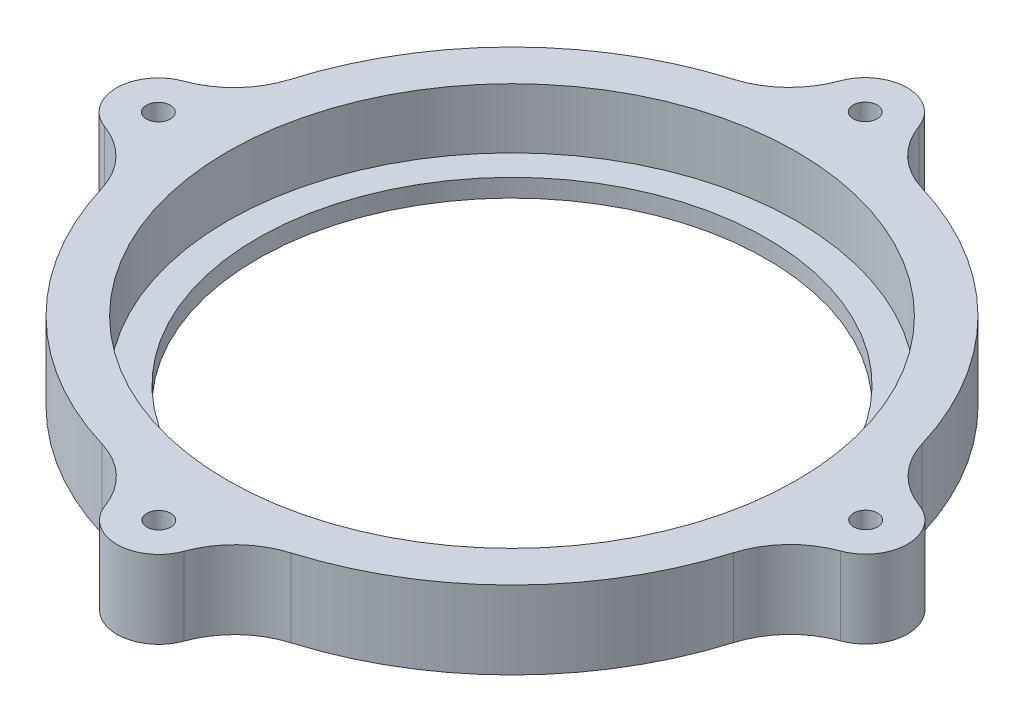
from build123d import *

# Parameters (mm, degrees)
SKETCH1_R           = 2
BOSS_EXTRUDE1_DEPTH = 13
SKETCH2_R           = 47.5
CUT_EXTRUDE1_DEPTH  = 10
SKETCH3_R           = 42.5
CUT_EXTRUDE2_DEPTH  = 10


with BuildPart() as part:
    # Sketch1 → Boss-Extrude1 (new body)
    # profile 1 of 4: a face of its own
    with BuildSketch(Plane(origin=(0, 0, 0), x_dir=(1, 0, 0), z_dir=(0, 1, 0))):
        with BuildLine():
            ThreePointArc((61.367242208, -6.544599037), (65.988588721, 0.043478359), (61.35856476, 6.625460242))
            ThreePointArc((61.35856476, 6.625460242), (55.933608349, 10.171878458), (52.687221143, 15.781531238))
            ThreePointArc((52.687221143, 15.781531238), (-54.999988062, -0.036238224), (52.707971563, -15.712088776))
            ThreePointArc((52.707971563, -15.712088776), (55.946963812, -10.098162928), (61.367242208, -6.544599037))
        make_face()
        with Locations(Location((58.98859024, 0.038866222, 0), (0, 0, 270))):
            Circle(SKETCH1_R, mode=Mode.SUBTRACT)
    # profile 2 of 4: a face of its own
    with BuildSketch(Plane(origin=(0, 0, 0), x_dir=(1, 0, 0), z_dir=(0, 1, 0))):
        with BuildLine():
            ThreePointArc((6.625460242, -61.35856476), (10.171878458, -55.933608349), (15.781531238, -52.687221143))
            ThreePointArc((15.781531238, -52.687221143), (0.036238224, -54.999988062), (-15.712088776, -52.707971563))
            ThreePointArc((-15.712088776, -52.707971563), (-10.098162928, -55.946963812), (-6.544599037, -61.367242208))
            ThreePointArc((-6.544599037, -61.367242208), (0.043478359, -65.988588721), (6.625460242, -61.35856476))
        make_face()
        with Locations(Location((0.038866222, -58.98859024, 0), (0, 0, 270))):
            Circle(SKETCH1_R, mode=Mode.SUBTRACT)
    # profile 3 of 4: a face of its own
    with BuildSketch(Plane(origin=(0, 0, 0), x_dir=(1, 0, 0), z_dir=(0, 1, 0))):
        with BuildLine():
            ThreePointArc((-52.687221143, -15.781531238), (-54.999988062, -0.036238224), (-52.707971563, 15.712088776))
            ThreePointArc((-52.707971563, 15.712088776), (-55.946963812, 10.098162928), (-61.367242208, 6.544599037))
            ThreePointArc((-61.367242208, 6.544599037), (-65.988588721, -0.043478359), (-61.35856476, -6.625460242))
            ThreePointArc((-61.35856476, -6.625460242), (-55.933608349, -10.171878458), (-52.687221143, -15.781531238))
        make_face()
        with Locations(Location((-58.98859024, -0.038866222, 0), (0, 0, 270))):
            Circle(SKETCH1_R, mode=Mode.SUBTRACT)
    # profile 4 of 4: a face of its own
    with BuildSketch(Plane(origin=(0, 0, 0), x_dir=(1, 0, 0), z_dir=(0, 1, 0))):
        with BuildLine():
            ThreePointArc((-15.781531238, 52.687221143), (-0.036238224, 54.999988062), (15.712088776, 52.707971563))
            ThreePointArc((15.712088776, 52.707971563), (10.098162928, 55.946963812), (6.544599037, 61.367242208))
            ThreePointArc((6.544599037, 61.367242208), (-0.043478359, 65.988588721), (-6.625460242, 61.35856476))
            ThreePointArc((-6.625460242, 61.35856476), (-10.171878458, 55.933608349), (-15.781531238, 52.687221143))
        make_face()
        with Locations(Location((-0.038866222, 58.98859024, 0), (0, 0, 270))):
            Circle(SKETCH1_R, mode=Mode.SUBTRACT)
    extrude(amount=-BOSS_EXTRUDE1_DEPTH)

    # Sketch2 → Cut-Extrude1 (cut)
    with BuildSketch(Plane(origin=(0, 0, 0), x_dir=(1, 0, 0), z_dir=(0, 1, 0))):
        with Locations(Location((0, 0, 0), (0, 0, 270))):
            Circle(SKETCH2_R)
    extrude(amount=-CUT_EXTRUDE1_DEPTH, mode=Mode.SUBTRACT)

    # Sketch3 → Cut-Extrude2 (cut)
    with BuildSketch(Plane(origin=(0, -10, 0), x_dir=(1, 0, 0), z_dir=(0, 1, 0))):
        with Locations(Location((0, 0, 0), (0, 0, 270))):
            Circle(SKETCH3_R)
    extrude(amount=-CUT_EXTRUDE2_DEPTH, mode=Mode.SUBTRACT)


solid = part.part
